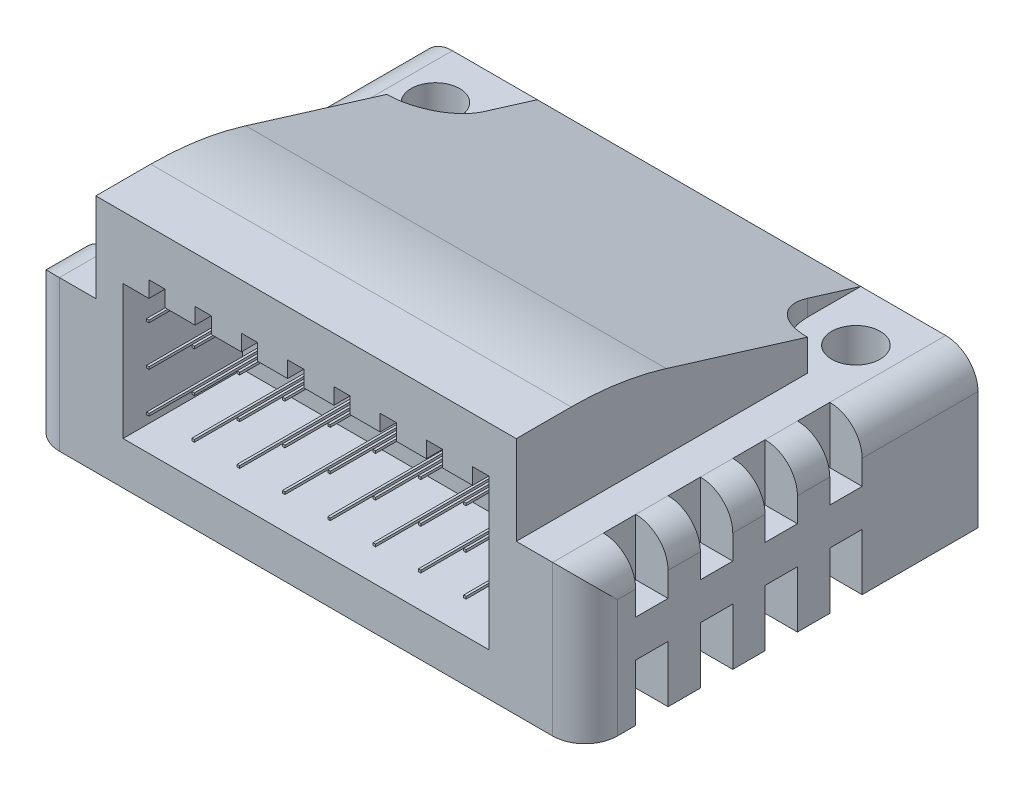
from build123d import *

# Parameters (mm, degrees)
SKETCH1_W               = 34.5
SKETCH1_H               = 24.3
BOSS_EXTRUDE1_DEPTH     = 9.3
BOSS_EXTRUDE2_DEPTH     = 26
FILLET1_R               = 2
FILLET2_R               = 20
SKETCH4_W               = 2
SKETCH4_H               = 2
SKETCH4_H_2             = 1.5
SKETCH4_H_3             = 3.5
CUT_EXTRUDE1_DEPTH      = 2
SKETCH5_W               = 2
SKETCH5_H               = 3.5
SKETCH5_H_2             = 2
SKETCH5_H_3             = 1.5
CUT_EXTRUDE2_DEPTH      = 2
CUT_EXTRUDE4_DEPTH      = 7.4
SKETCH8_W               = 0.15
SKETCH8_H               = 0.15
BOSS_EXTRUDE3_DEPTH     = 7.4
CUT_EXTRUDE5_DEPTH      = 24.058078845
CUT_EXTRUDE5_DEPTH_BACK = 24.058078845
SKETCH9_R               = 1.5
CUT_EXTRUDE6_DEPTH      = 24.058078845
SKETCH11_W              = 15.5
SKETCH11_H              = 5
CUT_EXTRUDE7_DEPTH      = 10
SKETCH12_W              = 1
SKETCH12_H              = 0.55
BOSS_EXTRUDE4_DEPTH     = 10
CUT_EXTRUDE8_DEPTH      = 10
SKETCH14_W              = 0.3
SKETCH14_H              = 0.3
BOSS_EXTRUDE5_DEPTH     = 10


with BuildPart() as part:
    # Sketch1 → Boss-Extrude1 (new body)
    with BuildSketch(Plane(origin=(0, 0, 0), x_dir=(1, 0, 0), z_dir=(0, 1, 0))):
        Rectangle(SKETCH1_W, SKETCH1_H)
    extrude(amount=BOSS_EXTRUDE1_DEPTH)

    # Sketch2 → Boss-Extrude2 (add)
    with BuildSketch(Plane(origin=(13, 0, 0), x_dir=(0, 0, -1), z_dir=(1, 0, 0))):
        Polygon((-12.15, 9.3), (12.15, 9.3), (-5.75, 14.8), (-12.15, 14.8), align=None)
    extrude(amount=-BOSS_EXTRUDE2_DEPTH)

    # Fillet1
    fillet1_edges = [part.edges().sort_by_distance(p)[0] for p in [
        (17.25, 9.3, 0),
        (-17.25, 9.3, 0),
        (17.25, 4.65, 12.15),
        (-17.25, 4.65, 12.15),
    ]]
    fillet(fillet1_edges, radius=FILLET1_R)

    # Fillet2
    fillet2_edges = [part.edges().sort_by_distance(p)[0] for p in [
        (0, 14.8, 5.75),
    ]]
    fillet(fillet2_edges, radius=FILLET2_R)

    # Sketch4 → Cut-Extrude1 (cut)
    with BuildSketch(Plane(origin=(17.25, 0, 0), x_dir=(0, 0, -1), z_dir=(1, 0, 0))):
        with Locations((-8.014423224, 8.3)):
            Rectangle(SKETCH4_W, SKETCH4_H)
        with Locations((-8.014423224, 6.55)):
            Rectangle(SKETCH4_W, SKETCH4_H_2)
        with Locations((-4.014423224, 8.3)):
            Rectangle(SKETCH4_W, SKETCH4_H)
        with Locations((-4.014423224, 6.55)):
            Rectangle(SKETCH4_W, SKETCH4_H_2)
        with Locations((-0.014423224, 8.3)):
            Rectangle(SKETCH4_W, SKETCH4_H)
        with Locations((-0.014423224, 6.55)):
            Rectangle(SKETCH4_W, SKETCH4_H_2)
        with Locations((3.985576776, 8.3)):
            Rectangle(SKETCH4_W, SKETCH4_H)
        with Locations((3.985576776, 6.55)):
            Rectangle(SKETCH4_W, SKETCH4_H_2)
        with Locations((-8.014423224, 1.75)):
            Rectangle(SKETCH4_W, SKETCH4_H_3)
        with Locations((-4.014423224, 1.75)):
            Rectangle(SKETCH4_W, SKETCH4_H_3)
        with Locations((-0.014423224, 1.75)):
            Rectangle(SKETCH4_W, SKETCH4_H_3)
        with Locations((3.985576776, 1.75)):
            Rectangle(SKETCH4_W, SKETCH4_H_3)
    extrude(amount=-CUT_EXTRUDE1_DEPTH, mode=Mode.SUBTRACT)

    # Sketch5 → Cut-Extrude2 (cut)
    with BuildSketch(Plane.ZY.offset(17.25)):
        with Locations((-3.985576776, 1.75)):
            Rectangle(SKETCH5_W, SKETCH5_H)
        with Locations((0.014423224, 1.75)):
            Rectangle(SKETCH5_W, SKETCH5_H)
        with Locations((4.014423224, 1.75)):
            Rectangle(SKETCH5_W, SKETCH5_H)
        with Locations((8.014423224, 1.75)):
            Rectangle(SKETCH5_W, SKETCH5_H)
        with Locations((-3.985576776, 8.3)):
            Rectangle(SKETCH5_W, SKETCH5_H_2)
        with Locations((-3.985576776, 6.55)):
            Rectangle(SKETCH5_W, SKETCH5_H_3)
        with Locations((0.014423224, 8.3)):
            Rectangle(SKETCH5_W, SKETCH5_H_2)
        with Locations((0.014423224, 6.55)):
            Rectangle(SKETCH5_W, SKETCH5_H_3)
        with Locations((4.014423224, 8.3)):
            Rectangle(SKETCH5_W, SKETCH5_H_2)
        with Locations((4.014423224, 6.55)):
            Rectangle(SKETCH5_W, SKETCH5_H_3)
        with Locations((8.014423224, 8.3)):
            Rectangle(SKETCH5_W, SKETCH5_H_2)
        with Locations((8.014423224, 6.55)):
            Rectangle(SKETCH5_W, SKETCH5_H_3)
    extrude(amount=-CUT_EXTRUDE2_DEPTH, mode=Mode.SUBTRACT)

    # Sketch6 → Cut-Extrude4 (cut)
    with BuildSketch(Plane.XY.offset(12.15)):
        Polygon((-6.855, 11.95), (-6.855, 10.95), (-8.715, 10.95), (-8.715, 11.95), (-9.715, 11.95), (-9.715, 10.95), (-11.315, 10.95), (-11.315, 2.65), (11.315, 2.65), (11.315, 10.95), (11.305, 10.95), (11.305, 11.95), (10.305, 11.95), (10.305, 10.95), (8.445, 10.95), (8.445, 11.95), (7.445, 11.95), (7.445, 10.95), (5.585, 10.95), (5.585, 11.95), (4.585, 11.95), (4.585, 10.95), (2.725, 10.95), (2.725, 11.95), (1.725, 11.95), (1.725, 10.95), (-0.135, 10.95), (-0.135, 11.95), (-1.135, 11.95), (-1.135, 10.95), (-2.995, 10.95), (-2.995, 11.95), (-3.995, 11.95), (-3.995, 10.95), (-5.855, 10.95), (-5.855, 11.95), align=None)
    extrude(amount=-CUT_EXTRUDE4_DEPTH, mode=Mode.SUBTRACT)

    # Sketch8 → Boss-Extrude3 (add)
    with BuildSketch(Plane.XY.offset(4.75)):
        with Locations((9.82, 9.725)):
            Rectangle(SKETCH8_W, SKETCH8_H)
        with Locations((9.82, 7.225)):
            Rectangle(SKETCH8_W, SKETCH8_H)
        with Locations((9.82, 4.725)):
            Rectangle(SKETCH8_W, SKETCH8_H)
        with Locations((7.02, 9.725)):
            Rectangle(SKETCH8_W, SKETCH8_H)
        with Locations((7.02, 7.225)):
            Rectangle(SKETCH8_W, SKETCH8_H)
        with Locations((7.02, 4.725)):
            Rectangle(SKETCH8_W, SKETCH8_H)
        with Locations((4.22, 9.725)):
            Rectangle(SKETCH8_W, SKETCH8_H)
        with Locations((4.22, 7.225)):
            Rectangle(SKETCH8_W, SKETCH8_H)
        with Locations((4.22, 4.725)):
            Rectangle(SKETCH8_W, SKETCH8_H)
        with Locations((1.42, 9.725)):
            Rectangle(SKETCH8_W, SKETCH8_H)
        with Locations((1.42, 7.225)):
            Rectangle(SKETCH8_W, SKETCH8_H)
        with Locations((1.42, 4.725)):
            Rectangle(SKETCH8_W, SKETCH8_H)
        with Locations((-1.38, 9.725)):
            Rectangle(SKETCH8_W, SKETCH8_H)
        with Locations((-1.38, 7.225)):
            Rectangle(SKETCH8_W, SKETCH8_H)
        with Locations((-1.38, 4.725)):
            Rectangle(SKETCH8_W, SKETCH8_H)
        with Locations((-4.18, 9.725)):
            Rectangle(SKETCH8_W, SKETCH8_H)
        with Locations((-4.18, 7.225)):
            Rectangle(SKETCH8_W, SKETCH8_H)
        with Locations((-4.18, 4.725)):
            Rectangle(SKETCH8_W, SKETCH8_H)
        with Locations((-6.98, 9.725)):
            Rectangle(SKETCH8_W, SKETCH8_H)
        with Locations((-6.98, 7.225)):
            Rectangle(SKETCH8_W, SKETCH8_H)
        with Locations((-6.98, 4.725)):
            Rectangle(SKETCH8_W, SKETCH8_H)
        with Locations((-9.78, 9.725)):
            Rectangle(SKETCH8_W, SKETCH8_H)
        with Locations((-9.78, 7.225)):
            Rectangle(SKETCH8_W, SKETCH8_H)
        with Locations((-9.78, 4.725)):
            Rectangle(SKETCH8_W, SKETCH8_H)
    extrude(amount=BOSS_EXTRUDE3_DEPTH)

    # Sketch9 → Cut-Extrude5 (cut, two sides: drawn at the far end of the back side and taken through both)
    with BuildSketch(Plane(origin=(0, 9.3, 0), x_dir=(1, 0, 0), z_dir=(0, 1, 0)).offset(-CUT_EXTRUDE5_DEPTH_BACK)):
        with Locations(Location((13, 8.85, 0), (0, 0, 270))):
            Circle(SKETCH9_R)
        with Locations(Location((-13, 8.85, 0), (0, 0, 270))):
            Circle(SKETCH9_R)
    extrude(amount=CUT_EXTRUDE5_DEPTH + CUT_EXTRUDE5_DEPTH_BACK, mode=Mode.SUBTRACT)

    # Sketch10 → Cut-Extrude6 (cut, through all)
    with BuildSketch(Plane(origin=(0, 9.3, 0), x_dir=(1, 0, 0), z_dir=(0, 1, 0))):
        with BuildLine():
            Line((-10, 8.85), (-10, 12.15))
            Line((-10, 12.15), (-13, 12.15))
            Line((-13, 12.15), (-13, 11.85))
            ThreePointArc((-13, 11.85), (-15.121320344, 6.728679656), (-10, 8.85))
        make_face()
        with BuildLine():
            Line((10, 8.85), (10, 12.15))
            Line((10, 12.15), (13, 12.15))
            Line((13, 12.15), (13, 11.85))
            ThreePointArc((13, 11.85), (15.121320344, 6.728679656), (10, 8.85))
        make_face()
    extrude(amount=CUT_EXTRUDE6_DEPTH, mode=Mode.SUBTRACT)

    # Sketch11 → Cut-Extrude7 (cut)
    with BuildSketch(Plane(origin=(0, 0, -12.15), x_dir=(-1, 0, 0), z_dir=(0, 0, -1))):
        with Locations((0, 6.15)):
            Rectangle(SKETCH11_W, SKETCH11_H)
    extrude(amount=-CUT_EXTRUDE7_DEPTH, mode=Mode.SUBTRACT)

    # Sketch12 → Boss-Extrude4 (add)
    with BuildSketch(Plane(origin=(0, 0, -2.15), x_dir=(-1, 0, 0), z_dir=(0, 0, -1))):
        Polygon((-7.693053134, 8.552251056), (7.693053134, 8.552251056), (7.693053134, 5.752251056), (7.4, 5.752251056), (7.4, 4.267900601), (6.884350455, 3.752251056), (-6.884350455, 3.752251056), (-7.4, 4.267900601), (-7.4, 5.752251056), (-7.693053134, 5.752251056), align=None)
        Polygon((-4.4, 8.452251056), (4.4, 8.452251056), (4.4, 6.952251056), (3.429935511, 6.952251056), (3.215636802, 7.152251056), (-3.215636802, 7.152251056), (-3.429935511, 6.952251056), (-4.4, 6.952251056), align=None, mode=Mode.SUBTRACT)
        with Locations((-5.25, 7.780218215)):
            Rectangle(SKETCH12_W, SKETCH12_H, mode=Mode.SUBTRACT)
        with Locations((5.25, 7.780218215)):
            Rectangle(SKETCH12_W, SKETCH12_H, mode=Mode.SUBTRACT)
        with Locations((6.7, 7.780218215)):
            Rectangle(SKETCH12_W, SKETCH12_H, mode=Mode.SUBTRACT)
        with Locations((-6.7, 7.780218215)):
            Rectangle(SKETCH12_W, SKETCH12_H, mode=Mode.SUBTRACT)
    extrude(amount=BOSS_EXTRUDE4_DEPTH)

    # Sketch13 → Cut-Extrude8 (cut)
    with BuildSketch(Plane(origin=(0, 0, -12.15), x_dir=(-1, 0, 0), z_dir=(0, 0, -1))):
        Polygon((-0.21, 6.715251056), (0.21, 6.715251056), (0.21, 6.345251056), (0.31, 6.345251056), (0.31, 6.715251056), (0.41, 6.715251056), (0.41, 6.345251056), (0.51, 6.345251056), (0.51, 6.715251056), (1.41, 6.715251056), (1.41, 6.345251056), (1.51, 6.345251056), (1.51, 6.715251056), (1.61, 6.715251056), (1.61, 6.345251056), (1.71, 6.345251056), (1.71, 6.715251056), (2.61, 6.715251056), (2.61, 6.345251056), (2.71, 6.345251056), (2.71, 6.715251056), (2.81, 6.715251056), (2.81, 6.345251056), (2.91, 6.345251056), (2.91, 6.715251056), (3.81, 6.715251056), (3.81, 6.345251056), (3.91, 6.345251056), (3.91, 6.715251056), (4.01, 6.715251056), (4.01, 6.345251056), (4.11, 6.345251056), (4.11, 6.715251056), (5.01, 6.715251056), (5.01, 6.345251056), (5.11, 6.345251056), (5.11, 6.715251056), (5.21, 6.715251056), (5.21, 6.345251056), (5.31, 6.345251056), (5.31, 6.715251056), (5.68, 6.715251056), (5.68, 6.925251056), (5.9, 6.925251056), (5.9, 6.715251056), (6.4, 6.715251056), (6.4, 7.215251056), (6.8, 7.215251056), (6.8, 4.215251056), (-6.8, 4.215251056), (-6.8, 7.215251056), (-6.4, 7.215251056), (-6.4, 6.715251056), (-5.9, 6.715251056), (-5.9, 6.925251056), (-5.68, 6.925251056), (-5.68, 6.715251056), (-5.31, 6.715251056), (-5.31, 6.345251056), (-5.21, 6.345251056), (-5.21, 6.715251056), (-5.11, 6.715251056), (-5.11, 6.345251056), (-5.01, 6.345251056), (-5.01, 6.715251056), (-4.11, 6.715251056), (-4.11, 6.345251056), (-4.01, 6.345251056), (-4.01, 6.715251056), (-3.91, 6.715251056), (-3.91, 6.345251056), (-3.81, 6.345251056), (-3.81, 6.715251056), (-2.91, 6.715251056), (-2.91, 6.345251056), (-2.81, 6.345251056), (-2.81, 6.715251056), (-2.71, 6.715251056), (-2.71, 6.345251056), (-2.61, 6.345251056), (-2.61, 6.715251056), (-1.71, 6.715251056), (-1.71, 6.345251056), (-1.61, 6.345251056), (-1.61, 6.715251056), (-1.51, 6.715251056), (-1.51, 6.345251056), (-1.41, 6.345251056), (-1.41, 6.715251056), (-0.51, 6.715251056), (-0.51, 6.345251056), (-0.41, 6.345251056), (-0.41, 6.715251056), (-0.31, 6.715251056), (-0.31, 6.345251056), (-0.21, 6.345251056), align=None)
    extrude(amount=-CUT_EXTRUDE8_DEPTH, mode=Mode.SUBTRACT)

    # Sketch14 → Boss-Extrude5 (add)
    with BuildSketch(Plane(origin=(0, 0, -12.15), x_dir=(-1, 0, 0), z_dir=(0, 0, -1))):
        with Locations((5.25, 4.365251056)):
            Rectangle(SKETCH14_W, SKETCH14_H)
        with Locations((4.07, 4.365251056)):
            Rectangle(SKETCH14_W, SKETCH14_H)
        with Locations((2.89, 4.365251056)):
            Rectangle(SKETCH14_W, SKETCH14_H)
        with Locations((1.71, 4.365251056)):
            Rectangle(SKETCH14_W, SKETCH14_H)
        with Locations((0.53, 4.365251056)):
            Rectangle(SKETCH14_W, SKETCH14_H)
        with Locations((-0.65, 4.365251056)):
            Rectangle(SKETCH14_W, SKETCH14_H)
        with Locations((-1.83, 4.365251056)):
            Rectangle(SKETCH14_W, SKETCH14_H)
        with Locations((-3.01, 4.365251056)):
            Rectangle(SKETCH14_W, SKETCH14_H)
        with Locations((-4.19, 4.365251056)):
            Rectangle(SKETCH14_W, SKETCH14_H)
        with Locations((-5.37, 4.365251056)):
            Rectangle(SKETCH14_W, SKETCH14_H)
    extrude(amount=-BOSS_EXTRUDE5_DEPTH)


solid = part.part
